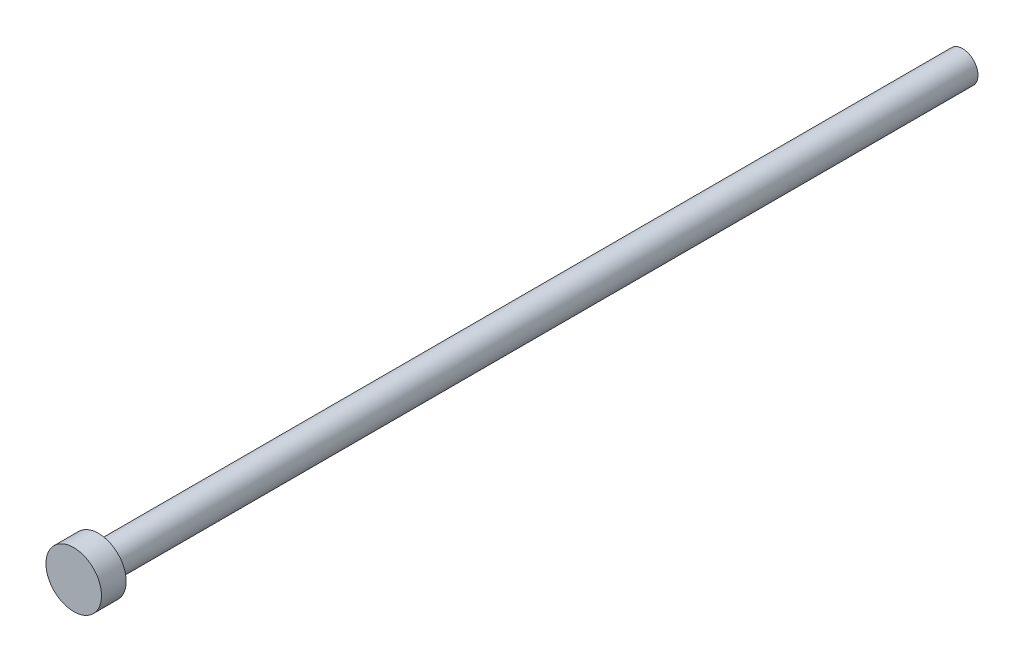
from build123d import *

# Parameters (mm, degrees)
EXTRUDE_START      = 225
EXTRUDE_SKETCH_1_R = 5
EXTRUDE_1_DEPTH    = 280
EXTRUDE_START_2    = 505
EXTRUDE_SKETCH_2_R = 9
EXTRUDE_2_DEPTH    = 8


with BuildPart() as part:
    # Extrude sketch 1 → Extrude 1 (new body)
    with BuildSketch(Plane.XY.offset(EXTRUDE_START)):
        with Locations((-111, 111)):
            Circle(EXTRUDE_SKETCH_1_R)
    extrude(amount=EXTRUDE_1_DEPTH)


with BuildPart() as body_2:
    # Extrude sketch 2 → Extrude 2 (new body)
    with BuildSketch(Plane.XY.offset(EXTRUDE_START_2)):
        with Locations((-111, 111)):
            Circle(EXTRUDE_SKETCH_2_R)
    extrude(amount=EXTRUDE_2_DEPTH)

    # Combine (weld / assembly of features): union part
    add(part.part)


solid = body_2.part
